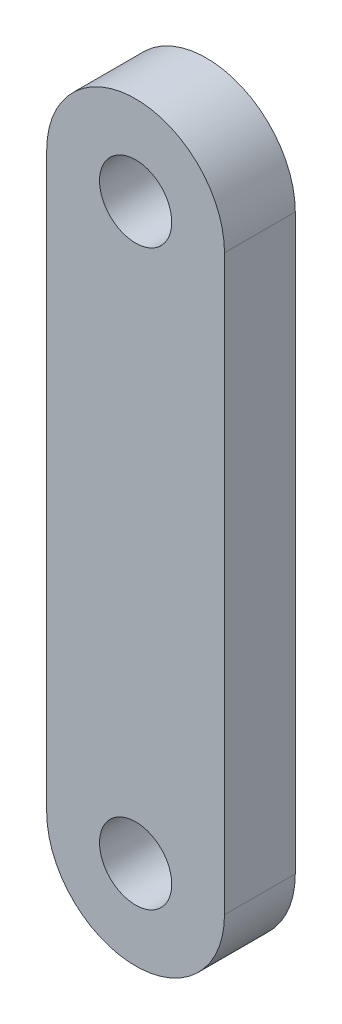
from build123d import *

# Parameters (mm, degrees)
SKETCH1_R           = 3.2385
BOSS_EXTRUDE1_DEPTH = 6.35


with BuildPart() as part:
    # Sketch1 → Boss-Extrude1 (new body)
    with BuildSketch(Plane.XY):
        with BuildLine():
            Line((7.9756, 38.075002032), (7.9756, -13.359997968))
            ThreePointArc((7.9756, -13.359997968), (0, -21.335597968), (-7.9756, -13.359997968))
            Line((-7.9756, -13.359997968), (-7.9756, 38.075002032))
            ThreePointArc((-7.9756, 38.075002032), (0, 46.050602032), (7.9756, 38.075002032))
        make_face()
        with Locations((0, 38.075002032)):
            Circle(SKETCH1_R, mode=Mode.SUBTRACT)
        with Locations((0, -13.359997968)):
            Circle(SKETCH1_R, mode=Mode.SUBTRACT)
    extrude(amount=BOSS_EXTRUDE1_DEPTH)


solid = part.part
